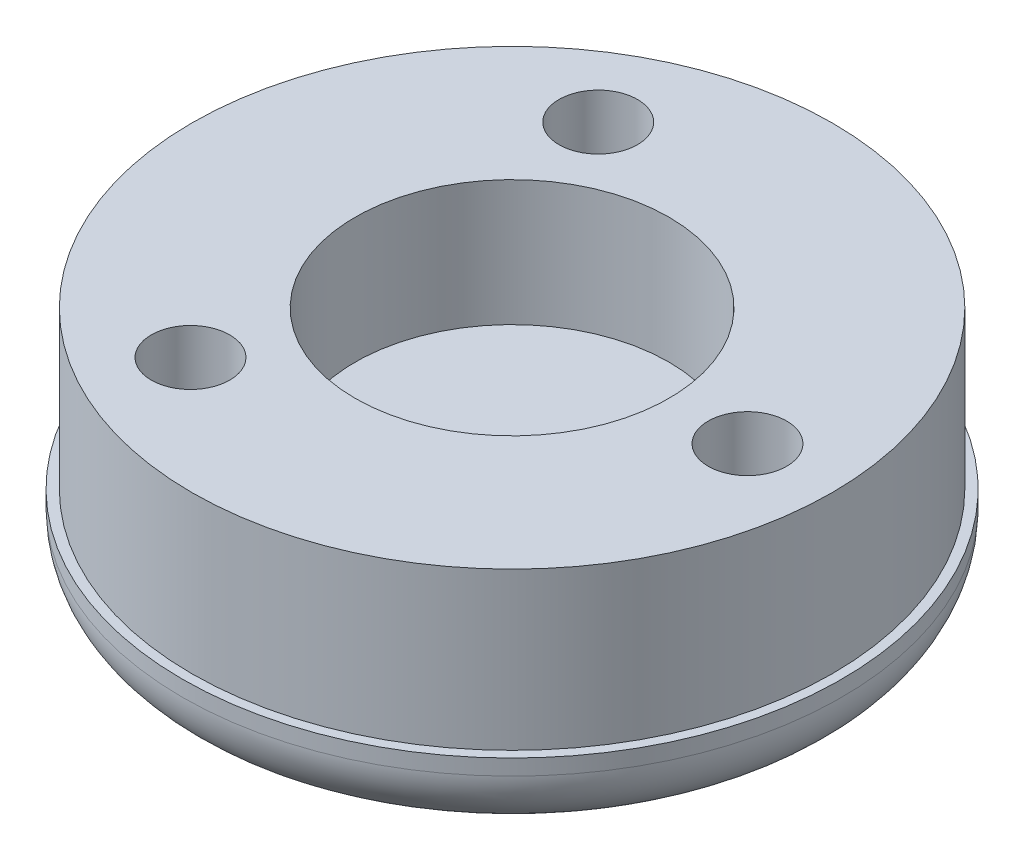
from build123d import *

# Parameters (mm, degrees)
SKETCH1_R           = 13.335
BOSS_EXTRUDE1_DEPTH = 3.175
SKETCH2_R           = 12.954
BOSS_EXTRUDE2_DEPTH = 6.35
SKETCH3_R           = 6.35
CUT_EXTRUDE2_DEPTH  = 5.08
SKETCH4_R           = 1.5875
CUT_EXTRUDE3_DEPTH  = 2.54
CIRPATTERN1_COUNT   = 3
FILLET1_R           = 2.54


with BuildPart() as part:
    # Sketch1 → Boss-Extrude1 (new body)
    with BuildSketch(Plane(origin=(0, 0, 0), x_dir=(1, 0, 0), z_dir=(0, 1, 0))):
        Circle(SKETCH1_R)
    extrude(amount=BOSS_EXTRUDE1_DEPTH)

    # Sketch2 → Boss-Extrude2 (add)
    with BuildSketch(Plane(origin=(0, 3.175, 0), x_dir=(1, 0, 0), z_dir=(0, 1, 0))):
        Circle(SKETCH2_R)
    extrude(amount=BOSS_EXTRUDE2_DEPTH)

    # Sketch3 → Cut-Extrude2 (cut)
    with BuildSketch(Plane(origin=(0, 9.525, 0), x_dir=(1, 0, 0), z_dir=(0, 1, 0))):
        Circle(SKETCH3_R)
    extrude(amount=-CUT_EXTRUDE2_DEPTH, mode=Mode.SUBTRACT)

    # Sketch4 → Cut-Extrude3 (cut)
    with BuildSketch(Plane(origin=(0, 9.525, 0), x_dir=(1, 0, 0), z_dir=(0, 1, 0))):
        with Locations((9.525, 0)):
            Circle(SKETCH4_R)
    cut_extrude3 = extrude(amount=-CUT_EXTRUDE3_DEPTH, mode=Mode.SUBTRACT)

    # CirPattern1: Cut-Extrude3 ×3 about axis
    cirpattern1_axis = Axis((0, 4.445, 0), (0, 1, 0))
    for i in range(1, CIRPATTERN1_COUNT):
        add(cut_extrude3.rotate(cirpattern1_axis, i * 360 / CIRPATTERN1_COUNT), mode=Mode.SUBTRACT)

    # Fillet1
    fillet1_edges = [part.edges().sort_by_distance(p)[0] for p in [
        (-13.335, 0, 0),
    ]]
    fillet(fillet1_edges, radius=FILLET1_R)


solid = part.part
